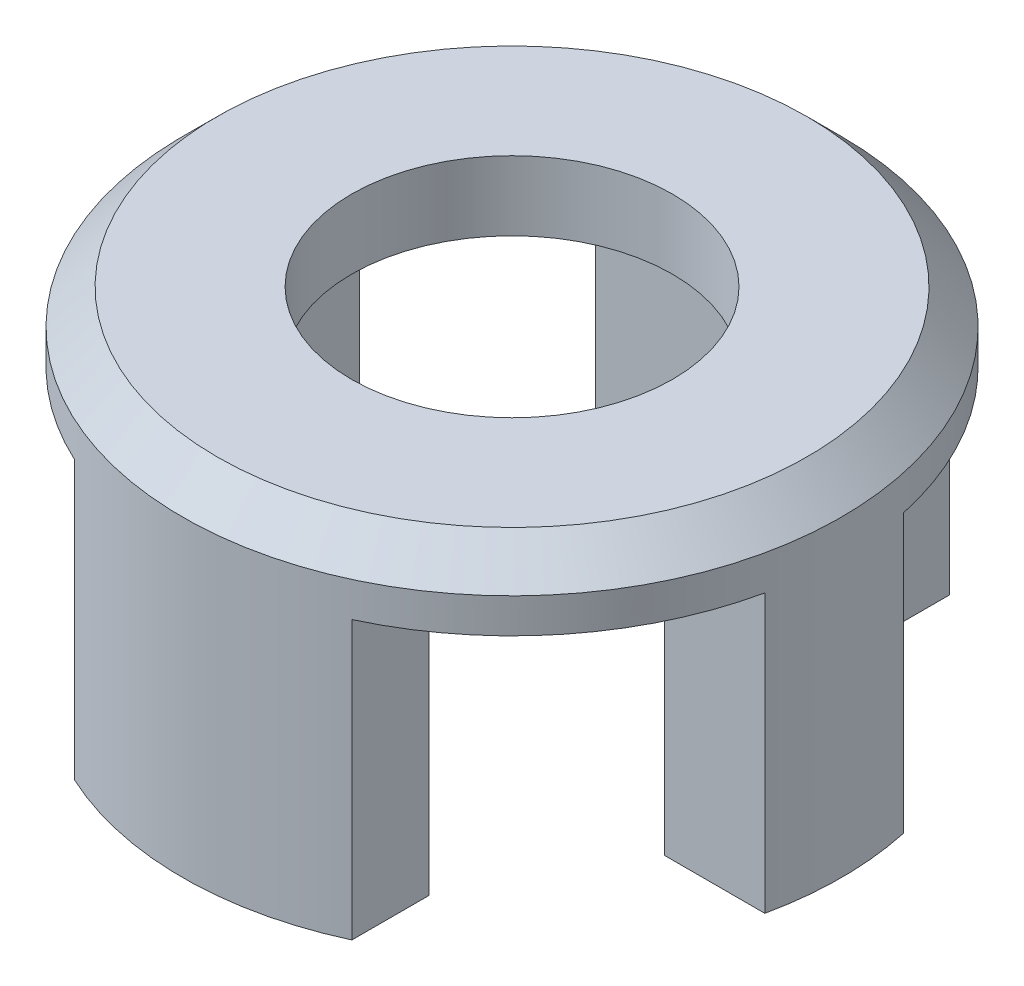
from build123d import *
from build123d.topology import SkipClean

# Parameters (mm, degrees)
BOSS_EXTRUDE1_DEPTH   = 5
BOSS_EXTRUDE1_2_DEPTH = 5
BOSS_EXTRUDE1_3_DEPTH = 5
BOSS_EXTRUDE1_4_DEPTH = 5
BOSS_EXTRUDE2_START   = -1
SKETCH2_R             = 4.75
SKETCH2_R_2           = 2.313447094
BOSS_EXTRUDE2_DEPTH   = 1
CHAMFER1_SIZE         = 0.5


with BuildPart() as part:
    # Sketch1 → Boss-Extrude1 (new body)
    with BuildSketch(Plane(origin=(0, 0, 0), x_dir=(1, 0, 0), z_dir=(0, 1, 0))):
        with BuildLine():
            Line((3.2, -1), (3.2, 1))
            Line((3.2, 1), (4.643543905, 1))
            ThreePointArc((4.643543905, 1), (4.75, 0), (4.643543905, -1))
            Line((4.643543905, -1), (3.2, -1))
        make_face()
    extrude(amount=BOSS_EXTRUDE1_DEPTH)



with BuildPart() as body_2:
    # Sketch1 → Boss-Extrude1 2 (new body)
    with BuildSketch(Plane(origin=(0, 0, 0), x_dir=(1, 0, 0), z_dir=(0, 1, 0))):
        with BuildLine():
            Line((-4.643543905, -1), (-3.2, -1))
            Line((-3.2, -1), (-3.2, 1))
            Line((-3.2, 1), (-4.643543905, 1))
            ThreePointArc((-4.643543905, 1), (-4.75, 0), (-4.643543905, -1))
        make_face()
    extrude(amount=BOSS_EXTRUDE1_2_DEPTH)


with BuildPart() as body_3:
    # Sketch1 → Boss-Extrude1 3 (new body)
    with BuildSketch(Plane(origin=(0, 0, 0), x_dir=(1, 0, 0), z_dir=(0, 1, 0))):
        with BuildLine():
            Line((-2, -4.308421985), (-2, -3.2))
            Line((-2, -3.2), (2, -3.2))
            Line((2, -3.2), (2, -4.308421985))
            ThreePointArc((2, -4.308421985), (0, -4.75), (-2, -4.308421985))
        make_face()
    extrude(amount=BOSS_EXTRUDE1_3_DEPTH)


with BuildPart() as body_4:
    # Sketch1 → Boss-Extrude1 4 (new body)
    with BuildSketch(Plane(origin=(0, 0, 0), x_dir=(1, 0, 0), z_dir=(0, 1, 0))):
        with BuildLine():
            Line((-2, 4.308421985), (-2, 3.2))
            Line((-2, 3.2), (2, 3.2))
            Line((2, 3.2), (2, 4.308421985))
            ThreePointArc((2, 4.308421985), (0, 4.75), (-2, 4.308421985))
        make_face()
    extrude(amount=BOSS_EXTRUDE1_4_DEPTH)


with BuildPart() as part_1:
    with SkipClean():  # the faces are left unmerged after this step: merging them gives an invalid solid
        add(part.part)

        add(body_2.part)  # Boss-Extrude2 merges body 2

        add(body_3.part)  # Boss-Extrude2 merges body 3

        add(body_4.part)  # Boss-Extrude2 merges body 4
        # Sketch2 → Boss-Extrude2 (add)
        with BuildSketch(Plane(origin=(0, 5, 0), x_dir=(1, 0, 0), z_dir=(0, 1, 0)).offset(BOSS_EXTRUDE2_START)):
            Circle(SKETCH2_R)
            Circle(SKETCH2_R_2, mode=Mode.SUBTRACT)
        extrude(amount=BOSS_EXTRUDE2_DEPTH)

    # Chamfer1
    chamfer1_edges = [part_1.edges().sort_by_distance(p)[0] for p in [
        (0, 5, -4.75),
    ]]
    chamfer(chamfer1_edges, length=CHAMFER1_SIZE)


solid = part_1.part
